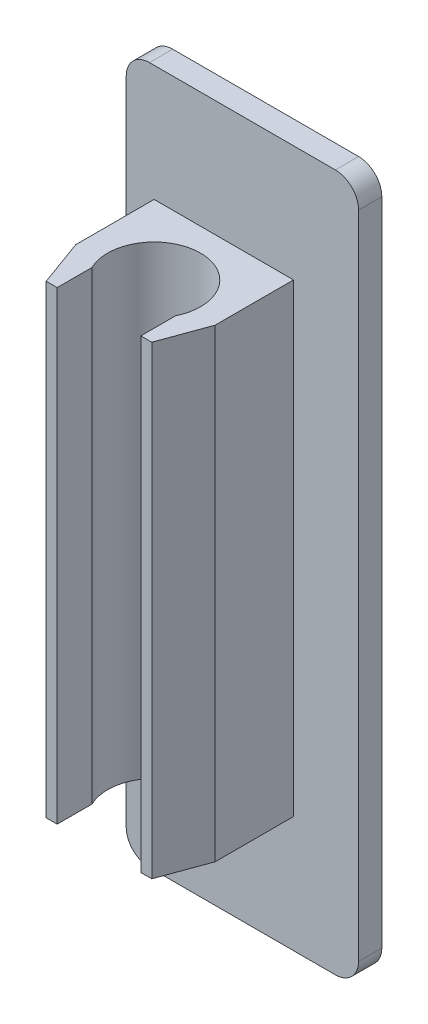
from build123d import *

# Parameters (mm, degrees)
SKETCH1_W           = 10
SKETCH1_H           = 30
BOSS_EXTRUDE1_DEPTH = 1
BOSS_EXTRUDE2_DEPTH = 10
FILLET1_R           = 1


with BuildPart() as part:
    # Sketch1 → Boss-Extrude1 (new body)
    with BuildSketch(Plane.XY):
        Rectangle(SKETCH1_W, SKETCH1_H)
    extrude(amount=BOSS_EXTRUDE1_DEPTH)

    # Sketch3 → Boss-Extrude2 (add, symmetric)
    with BuildSketch(Plane.XZ):
        with BuildLine():
            Line((-3.8, 1), (-3.8, 4.371779789))
            Line((-3.8, 4.371779789), (-3.072059531, 6.371779789))
            Line((-3.072059531, 6.371779789), (-2.6, 6.371779789))
            Line((-2.6, 6.371779789), (-2.6, 4.871779789))
            ThreePointArc((-2.6, 4.871779789), (-0.8, 2), (1, 4.871779789))
            Line((1, 4.871779789), (1, 6.371779789))
            Line((1, 6.371779789), (1.472059531, 6.371779789))
            Line((1.472059531, 6.371779789), (2.2, 4.371779789))
            Line((2.2, 4.371779789), (2.2, 1))
            Line((2.2, 1), (-3.8, 1))
        make_face()
    extrude(amount=BOSS_EXTRUDE2_DEPTH, both=True)

    # Fillet1
    fillet1_edges = [part.edges().sort_by_distance(p)[0] for p in [
        (-5, 15, 0.5),
        (5, 15, 0.5),
        (5, -15, 0.5),
        (-5, -15, 0.5),
    ]]
    fillet(fillet1_edges, radius=FILLET1_R)


solid = part.part
